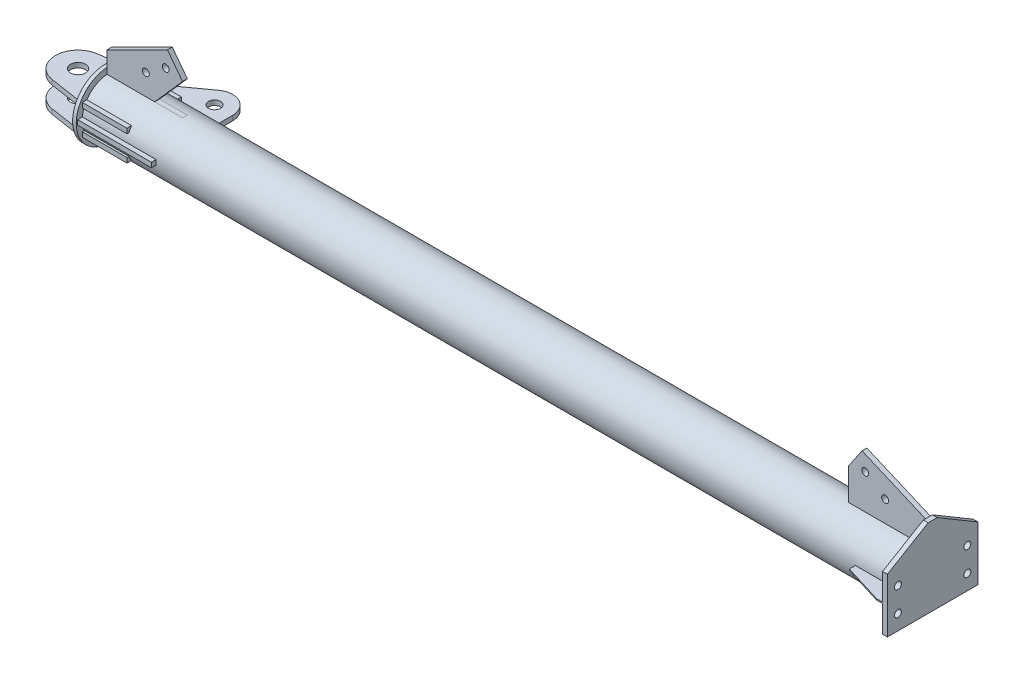
from build123d import *

# Parameters (mm, degrees)
SKETCH_2_R           = 90
EXTRUDE_1_DEPTH      = 2710
EXTRUDE_2_DEPTH      = 16
SKETCH_4_R           = 11.5
CUT_EXTRUDE_1_DEPTH  = 2736.411486413
SKETCH_5_W           = 300
SKETCH_5_H           = 4
EXTRUDE_3_DEPTH      = 150
CUT_EXTRUDE_2_DEPTH  = 2736.536510449
SKETCH_7_W           = 16
SKETCH_7_H           = 260
EXTRUDE_4_DEPTH      = 255
CUT_EXTRUDE_3_DEPTH  = 2743.925445578
CUT_EXTRUDE_4_DEPTH  = 2743.925445578
SKETCH_11_R          = 11.5
CUT_EXTRUDE_5_DEPTH  = 2743.925445578
SKETCH_12_R          = 110
EXTRUDE_5_DEPTH      = 12
SKETCH_14_W          = 16
SKETCH_14_H          = 260
EXTRUDE_6_DEPTH      = 250
CUT_EXTRUDE_7_DEPTH  = 2743.925445578
CUT_EXTRUDE_8_DEPTH  = 2743.925445578
SKETCH_17_R          = 11.5
CUT_EXTRUDE_9_DEPTH  = 2743.925445578
SKETCH_18_W          = 180
SKETCH_18_H          = 16
EXTRUDE_7_DEPTH      = 167
CUT_EXTRUDE_10_DEPTH = 2748.667374338
CUT_EXTRUDE_11_DEPTH = 2748.667374338
SKETCH_21_R          = 25
CUT_EXTRUDE_12_DEPTH = 2748.667374338
SKETCH_22_W          = 180
SKETCH_22_H          = 16
EXTRUDE_8_DEPTH      = 160
SKETCH_23_W          = 244
SKETCH_23_H          = 16
EXTRUDE_9_DEPTH      = 329
CUT_EXTRUDE_13_DEPTH = 2749.286011317
CUT_EXTRUDE_14_DEPTH = 2749.286011317
SKETCH_27_R          = 20
CUT_EXTRUDE_15_DEPTH = 2749.286011317


with BuildPart() as part:
    # 草图2 → 凸台-拉伸1 (new body)
    with BuildSketch(Plane(origin=(0, 0, 0), x_dir=(0, 0, -1), z_dir=(1, 0, 0))):
        Circle(SKETCH_2_R)
    extrude(amount=EXTRUDE_1_DEPTH)

    # 草图3 → 凸台-拉伸2 (add)
    with BuildSketch(Plane(origin=(2710, 0, 0), x_dir=(0, 0, -1), z_dir=(1, 0, 0))):
        Polygon((-150, -90), (150, -90), (150, 90), (15, 170), (-15, 170), (-150, 90), align=None)
    extrude(amount=EXTRUDE_2_DEPTH)

    # 草图4 → 切除-拉伸1 (cut, through all)
    with BuildSketch(Plane(origin=(2726, 0, 0), x_dir=(0, 0, -1), z_dir=(1, 0, 0))):
        with Locations((115, -40)):
            Circle(SKETCH_4_R)
        with Locations((115, 40)):
            Circle(SKETCH_4_R)
        with Locations((-115, 40)):
            Circle(SKETCH_4_R)
        with Locations((-115, -40)):
            Circle(SKETCH_4_R)
    extrude(amount=-CUT_EXTRUDE_1_DEPTH, mode=Mode.SUBTRACT)

    # 草图5 → 凸台-拉伸3 (add)
    with BuildSketch(Plane.ZY.offset(-2710)):
        Rectangle(SKETCH_5_W, SKETCH_5_H)
    extrude(amount=EXTRUDE_3_DEPTH)

    # 草图6 → 切除-拉伸2 (cut, through all)
    with BuildSketch(Plane.XZ.offset(2)):
        Polygon((2690, 150), (2560, 109.977775034), (2560, 150), align=None)
        Polygon((2560, -109.977775034), (2560, -150), (2690, -150), align=None)
    extrude(amount=-CUT_EXTRUDE_2_DEPTH, mode=Mode.SUBTRACT)

    # 草图7 → 凸台-拉伸4 (add)
    with BuildSketch(Plane.ZY.offset(-2710)):
        with Locations((0, 130)):
            Rectangle(SKETCH_7_W, SKETCH_7_H)
    extrude(amount=EXTRUDE_4_DEPTH)

    # 草图9 → 切除-拉伸3 (cut, through all)
    with BuildSketch(Plane(origin=(0, 0, -8), x_dir=(-1, 0, 0), z_dir=(0, 0, -1))):
        Polygon((-2710, 260), (-2500, 260), (-2710, 170), align=None)
    extrude(amount=-CUT_EXTRUDE_3_DEPTH, mode=Mode.SUBTRACT)

    # 草图10 → 切除-拉伸4 (cut, through all)
    with BuildSketch(Plane(origin=(0, 0, -8), x_dir=(-1, 0, 0), z_dir=(0, 0, -1))):
        Polygon((-2500, 260), (-2455, 194), (-2455, 260), align=None)
    extrude(amount=-CUT_EXTRUDE_4_DEPTH, mode=Mode.SUBTRACT)

    # 草图11 → 切除-拉伸5 (cut, through all)
    with BuildSketch(Plane(origin=(0, 0, -8), x_dir=(-1, 0, 0), z_dir=(0, 0, -1))):
        with Locations((-2576.522543277, 159.619021786)):
            Circle(SKETCH_11_R)
        with Locations((-2510.571491725, 204.901013782)):
            Circle(SKETCH_11_R)
    extrude(amount=-CUT_EXTRUDE_5_DEPTH, mode=Mode.SUBTRACT)

    # 草图12 → 凸台-拉伸5 (add)
    with BuildSketch(Plane.ZY):
        Circle(SKETCH_12_R)
    extrude(amount=EXTRUDE_5_DEPTH)

    # 草图14 → 凸台-拉伸6 (add)
    with BuildSketch(Plane(origin=(0, 0, 0), x_dir=(0, 0, -1), z_dir=(1, 0, 0))):
        with Locations((0, 130)):
            Rectangle(SKETCH_14_W, SKETCH_14_H)
    extrude(amount=EXTRUDE_6_DEPTH)

    # 草图15 → 切除-拉伸7 (cut, through all)
    with BuildSketch(Plane(origin=(0, 0, -8), x_dir=(-1, 0, 0), z_dir=(0, 0, -1))):
        Polygon((-250, 194), (-250, 89.643739324), (-158, 89.643739324), align=None)
        Polygon((-200, 260), (0, 160), (0, 260), align=None)
    extrude(amount=-CUT_EXTRUDE_7_DEPTH, mode=Mode.SUBTRACT)

    # 草图16 → 切除-拉伸8 (cut, through all)
    with BuildSketch(Plane(origin=(0, 0, -8), x_dir=(-1, 0, 0), z_dir=(0, 0, -1))):
        Polygon((-250, 260), (-200, 260), (-250, 194), align=None)
    extrude(amount=-CUT_EXTRUDE_8_DEPTH, mode=Mode.SUBTRACT)

    # 草图17 → 切除-拉伸9 (cut, through all)
    with BuildSketch(Plane(origin=(0, 0, -8), x_dir=(-1, 0, 0), z_dir=(0, 0, -1))):
        with Locations((-128.477456723, 159.619021786)):
            Circle(SKETCH_17_R)
        with Locations((-194.428508275, 204.901013782)):
            Circle(SKETCH_17_R)
    extrude(amount=-CUT_EXTRUDE_9_DEPTH, mode=Mode.SUBTRACT)

    # 草图18 → 凸台-拉伸7 (add)
    with BuildSketch(Plane.ZY.offset(12)):
        with Locations((0, 42)):
            Rectangle(SKETCH_18_W, SKETCH_18_H)
        with Locations((0, -42)):
            Rectangle(SKETCH_18_W, SKETCH_18_H)
    extrude(amount=EXTRUDE_7_DEPTH)

    # 草图19 → 切除-拉伸10 (cut, through all)
    with BuildSketch(Plane.XZ.offset(50)):
        with BuildLine():
            Line((-115.378912249, 74.131776965), (-12, 90))
            Line((-12, 90), (-179, 90))
            Line((-179, 90), (-179, 0))
            ThreePointArc((-179, 0), (-160.914051071, 48.844557431), (-115.378912249, 74.131776965))
        make_face()
    extrude(amount=-CUT_EXTRUDE_10_DEPTH, mode=Mode.SUBTRACT)

    # 草图20 → 切除-拉伸11 (cut, through all)
    with BuildSketch(Plane.XZ.offset(50)):
        with BuildLine():
            Line((-115.378912249, -74.131776965), (-12, -90))
            Line((-12, -90), (-179, -90))
            Line((-179, -90), (-179, 0))
            ThreePointArc((-179, 0), (-160.914051071, -48.844557431), (-115.378912249, -74.131776965))
        make_face()
    extrude(amount=-CUT_EXTRUDE_11_DEPTH, mode=Mode.SUBTRACT)

    # 草图21 → 切除-拉伸12 (cut, through all)
    with BuildSketch(Plane.XZ.offset(50)):
        with Locations((-104, 0)):
            Circle(SKETCH_21_R)
    extrude(amount=-CUT_EXTRUDE_12_DEPTH, mode=Mode.SUBTRACT)

    # 草图22 → 凸台-拉伸8 (add)
    with BuildSketch(Plane.ZY.offset(12)):
        with Locations((0, 42)):
            Rectangle(SKETCH_22_W, SKETCH_22_H)
        with Locations((0, -42)):
            Rectangle(SKETCH_22_W, SKETCH_22_H)
    extrude(amount=-EXTRUDE_8_DEPTH)

    # 草图23 → 凸台-拉伸9 (add)
    with BuildSketch(Plane.XY.offset(105)):
        with Locations((122, 0)):
            Rectangle(SKETCH_23_W, SKETCH_23_H)
    extrude(amount=-EXTRUDE_9_DEPTH)

    # 草图25 → 切除-拉伸13 (cut, through all)
    with BuildSketch(Plane(origin=(0, -8, 0), x_dir=(-1, 0, 0), z_dir=(0, -1, 0))):
        with BuildLine():
            Line((-244, 164), (-244, 224))
            Line((-244, 224), (-184, 224))
            ThreePointArc((-184, 224), (-226.426406871, 206.426406871), (-244, 164))
        make_face()
    extrude(amount=-CUT_EXTRUDE_13_DEPTH, mode=Mode.SUBTRACT)

    # 草图26 → 切除-拉伸14 (cut, through all)
    with BuildSketch(Plane.XZ.offset(8)):
        with BuildLine():
            Line((148.844142163, -212.62165834), (0, -105))
            Line((0, -105), (0, -224))
            Line((0, -224), (184, -224))
            ThreePointArc((184, -224), (165.524333576, -221.084584173), (148.844142163, -212.62165834))
        make_face()
    extrude(amount=-CUT_EXTRUDE_14_DEPTH, mode=Mode.SUBTRACT)

    # 草图27 → 切除-拉伸15 (cut, through all)
    with BuildSketch(Plane.XZ.offset(8)):
        with Locations((184, -164)):
            Circle(SKETCH_27_R)
    extrude(amount=-CUT_EXTRUDE_15_DEPTH, mode=Mode.SUBTRACT)


solid = part.part
